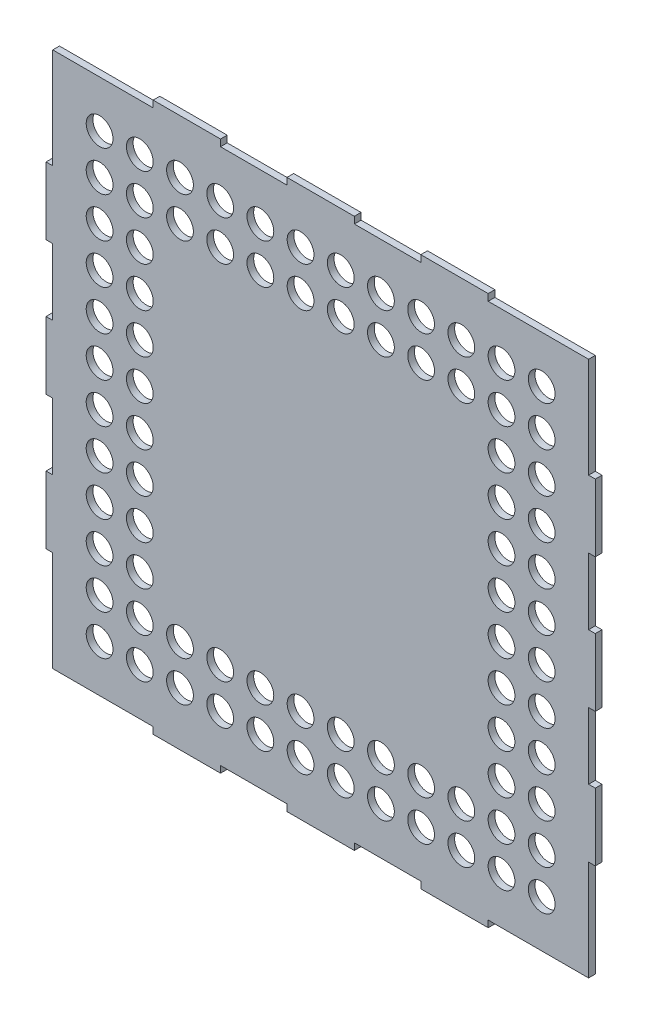
from build123d import *

# Parameters (mm, degrees)
SKIZZE1_W                       = 410
SKIZZE1_H                       = 410
AUFSATZ_LINEAR_AUSTRAGEN1_DEPTH = 5
SKIZZE2_W                       = 97.796702903
SKIZZE2_H                       = 49.6
SCHNITT_LINEAR_AUSTRAGEN1_DEPTH = 5
LINEARES_MUSTER1_COUNT          = 4
LINEARES_MUSTER1_PITCH          = 99.9
SPIEGELN1_COPY_1_SKETCH_W       = 97.796702903
SPIEGELN1_COPY_1_SKETCH_H       = 49.6
SPIEGELN1_COPY_1_DEPTH          = 5
SPIEGELN1_COPY_2_SKETCH_W       = 97.796702903
SPIEGELN1_COPY_2_SKETCH_H       = 49.6
SPIEGELN1_COPY_2_DEPTH          = 5
SPIEGELN1_COPY_3_SKETCH_W       = 97.796702903
SPIEGELN1_COPY_3_SKETCH_H       = 49.6
SPIEGELN1_COPY_3_DEPTH          = 5
SKIZZE3_W                       = 49.6
SKIZZE3_H                       = 41.77912255
SCHNITT_LINEAR_AUSTRAGEN2_DEPTH = 5
LINEARES_MUSTER2_COUNT          = 4
LINEARES_MUSTER2_PITCH          = 99.9
SPIEGELN2_COPY_1_SKETCH_W       = 49.6
SPIEGELN2_COPY_1_SKETCH_H       = 41.77912255
SPIEGELN2_COPY_1_DEPTH          = 5
SPIEGELN2_COPY_2_SKETCH_W       = 49.6
SPIEGELN2_COPY_2_SKETCH_H       = 41.77912255
SPIEGELN2_COPY_2_DEPTH          = 5
SPIEGELN2_COPY_3_SKETCH_W       = 49.6
SPIEGELN2_COPY_3_SKETCH_H       = 41.77912255
SPIEGELN2_COPY_3_DEPTH          = 5
SCHNITT_LINEAR_AUSTRAGEN3_DEPTH = 5
SPIEGELN4_COPY_1_DEPTH          = 5
SKIZZE5_R                       = 10
SCHNITT_LINEAR_AUSTRAGEN4_DEPTH = 5
LINEARES_MUSTER3_COUNT          = 12
LINEARES_MUSTER3_PITCH          = 30
LINEARES_MUSTER3_COUNT_DIR2     = 12
LINEARES_MUSTER3_PITCH_DIR2     = 30


with BuildPart() as part:
    # Skizze1 → Aufsatz-Linear austragen1 (new body)
    with BuildSketch(Plane.XY):
        with Locations((205, 205)):
            Rectangle(SKIZZE1_W, SKIZZE1_H)
    extrude(amount=AUFSATZ_LINEAR_AUSTRAGEN1_DEPTH)

    # Skizze2 → Schnitt-Linear austragen1 (cut)
    with BuildSketch(Plane.XY.offset(5)):
        with Locations((-43.898351452, 354.85)):
            Rectangle(SKIZZE2_W, SKIZZE2_H)
    schnitt_linear_austragen1 = extrude(amount=-SCHNITT_LINEAR_AUSTRAGEN1_DEPTH, mode=Mode.SUBTRACT)

    # Lineares Muster1: Schnitt-Linear austragen1 ×4
    with Locations(*[(0, -i * LINEARES_MUSTER1_PITCH, 0) for i in range(1, LINEARES_MUSTER1_COUNT)]):
        add(schnitt_linear_austragen1, mode=Mode.SUBTRACT)

    # Spiegeln1: Schnitt-Linear austragen1 across plane
    add(schnitt_linear_austragen1.mirror(Plane(origin=(205, 0, 0), x_dir=(0, 0, 1), z_dir=(1, 0, 0))), mode=Mode.SUBTRACT)

    # Spiegeln1 copy 1 sketch → Spiegeln1 copy 1 (cut)
    with BuildSketch(Plane(origin=(410, -99.9, 5), x_dir=(-1, 0, 0), z_dir=(0, 0, 1))):
        with Locations((-43.898351452, -354.85)):
            Rectangle(SPIEGELN1_COPY_1_SKETCH_W, SPIEGELN1_COPY_1_SKETCH_H)
    extrude(amount=-SPIEGELN1_COPY_1_DEPTH, mode=Mode.SUBTRACT)

    # Spiegeln1 copy 2 sketch → Spiegeln1 copy 2 (cut)
    with BuildSketch(Plane(origin=(410, -199.8, 5), x_dir=(-1, 0, 0), z_dir=(0, 0, 1))):
        with Locations((-43.898351452, -354.85)):
            Rectangle(SPIEGELN1_COPY_2_SKETCH_W, SPIEGELN1_COPY_2_SKETCH_H)
    extrude(amount=-SPIEGELN1_COPY_2_DEPTH, mode=Mode.SUBTRACT)

    # Spiegeln1 copy 3 sketch → Spiegeln1 copy 3 (cut)
    with BuildSketch(Plane(origin=(410, -299.7, 5), x_dir=(-1, 0, 0), z_dir=(0, 0, 1))):
        with Locations((-43.898351452, -354.85)):
            Rectangle(SPIEGELN1_COPY_3_SKETCH_W, SPIEGELN1_COPY_3_SKETCH_H)
    extrude(amount=-SPIEGELN1_COPY_3_DEPTH, mode=Mode.SUBTRACT)

    # Skizze3 → Schnitt-Linear austragen2 (cut)
    with BuildSketch(Plane.XY.offset(5)):
        with Locations((55.15, 425.889561275)):
            Rectangle(SKIZZE3_W, SKIZZE3_H)
    schnitt_linear_austragen2 = extrude(amount=-SCHNITT_LINEAR_AUSTRAGEN2_DEPTH, mode=Mode.SUBTRACT)

    # Lineares Muster2: Schnitt-Linear austragen2 ×4
    with Locations(*[(i * LINEARES_MUSTER2_PITCH, 0, 0) for i in range(1, LINEARES_MUSTER2_COUNT)]):
        add(schnitt_linear_austragen2, mode=Mode.SUBTRACT)

    # Spiegeln2: Schnitt-Linear austragen2 across plane
    add(schnitt_linear_austragen2.mirror(Plane.ZX.offset(205)), mode=Mode.SUBTRACT)

    # Spiegeln2 copy 1 sketch → Spiegeln2 copy 1 (cut)
    with BuildSketch(Plane(origin=(99.9, 410, 5), x_dir=(1, 0, 0), z_dir=(0, 0, 1))):
        with Locations((55.15, -425.889561275)):
            Rectangle(SPIEGELN2_COPY_1_SKETCH_W, SPIEGELN2_COPY_1_SKETCH_H)
    extrude(amount=-SPIEGELN2_COPY_1_DEPTH, mode=Mode.SUBTRACT)

    # Spiegeln2 copy 2 sketch → Spiegeln2 copy 2 (cut)
    with BuildSketch(Plane(origin=(199.8, 410, 5), x_dir=(1, 0, 0), z_dir=(0, 0, 1))):
        with Locations((55.15, -425.889561275)):
            Rectangle(SPIEGELN2_COPY_2_SKETCH_W, SPIEGELN2_COPY_2_SKETCH_H)
    extrude(amount=-SPIEGELN2_COPY_2_DEPTH, mode=Mode.SUBTRACT)

    # Spiegeln2 copy 3 sketch → Spiegeln2 copy 3 (cut)
    with BuildSketch(Plane(origin=(299.7, 410, 5), x_dir=(1, 0, 0), z_dir=(0, 0, 1))):
        with Locations((55.15, -425.889561275)):
            Rectangle(SPIEGELN2_COPY_3_SKETCH_W, SPIEGELN2_COPY_3_SKETCH_H)
    extrude(amount=-SPIEGELN2_COPY_3_DEPTH, mode=Mode.SUBTRACT)

    # Skizze4 → Schnitt-Linear austragen3 (cut)
    with BuildSketch(Plane.XY.offset(5)):
        Polygon((5, 379.65), (5, 405), (30.35, 405), (30.35, 431.549801047), (5, 431.549801047), (-47.862925009, 431.549801047), (-47.862925009, 405), (-47.862925009, 379.65), align=None)
    schnitt_linear_austragen3 = extrude(amount=-SCHNITT_LINEAR_AUSTRAGEN3_DEPTH, mode=Mode.SUBTRACT)

    # Spiegeln3: Schnitt-Linear austragen3 across plane
    add(schnitt_linear_austragen3.mirror(Plane(origin=(205, 0, 0), x_dir=(0, 0, 1), z_dir=(1, 0, 0))), mode=Mode.SUBTRACT)

    # Spiegeln4: Schnitt-Linear austragen3 across plane
    add(schnitt_linear_austragen3.mirror(Plane.ZX.offset(205)), mode=Mode.SUBTRACT)

    # Spiegeln4 copy 1 sketch → Spiegeln4 copy 1 (cut)
    with BuildSketch(Plane(origin=(410, 410, 5), x_dir=(-1, 0, 0), z_dir=(0, 0, 1))):
        Polygon((5, 379.65), (5, 405), (30.35, 405), (30.35, 431.549801047), (5, 431.549801047), (-47.862925009, 431.549801047), (-47.862925009, 405), (-47.862925009, 379.65), align=None)
    extrude(amount=-SPIEGELN4_COPY_1_DEPTH, mode=Mode.SUBTRACT)

    # Skizze5 → Schnitt-Linear austragen4 (cut)
    with BuildSketch(Plane.XY.offset(5)):
        with Locations((40, 370)):
            Circle(SKIZZE5_R)
    schnitt_linear_austragen4 = extrude(amount=-SCHNITT_LINEAR_AUSTRAGEN4_DEPTH, mode=Mode.SUBTRACT)

    # Lineares Muster3: Schnitt-Linear austragen4 12 × 12, 64 skipped
    with Locations(*[(i * LINEARES_MUSTER3_PITCH, -j * LINEARES_MUSTER3_PITCH_DIR2, 0) for i in range(LINEARES_MUSTER3_COUNT) for j in range(LINEARES_MUSTER3_COUNT_DIR2) if (i, j) not in ((0, 0), (2, 2), (2, 3), (2, 4), (2, 5), (2, 6), (2, 7), (2, 8), (2, 9), (3, 2), (3, 3), (3, 4), (3, 5), (3, 6), (3, 7), (3, 8), (3, 9), (4, 2), (4, 3), (4, 4), (4, 5), (4, 6), (4, 7), (4, 8), (4, 9), (5, 2), (5, 3), (5, 4), (5, 5), (5, 6), (5, 7), (5, 8), (5, 9), (6, 2), (6, 3), (6, 4), (6, 5), (6, 6), (6, 7), (6, 8), (6, 9), (7, 2), (7, 3), (7, 4), (7, 5), (7, 6), (7, 7), (7, 8), (7, 9), (8, 2), (8, 3), (8, 4), (8, 5), (8, 6), (8, 7), (8, 8), (8, 9), (9, 2), (9, 3), (9, 4), (9, 5), (9, 6), (9, 7), (9, 8), (9, 9))]):
        add(schnitt_linear_austragen4, mode=Mode.SUBTRACT)


solid = part.part
